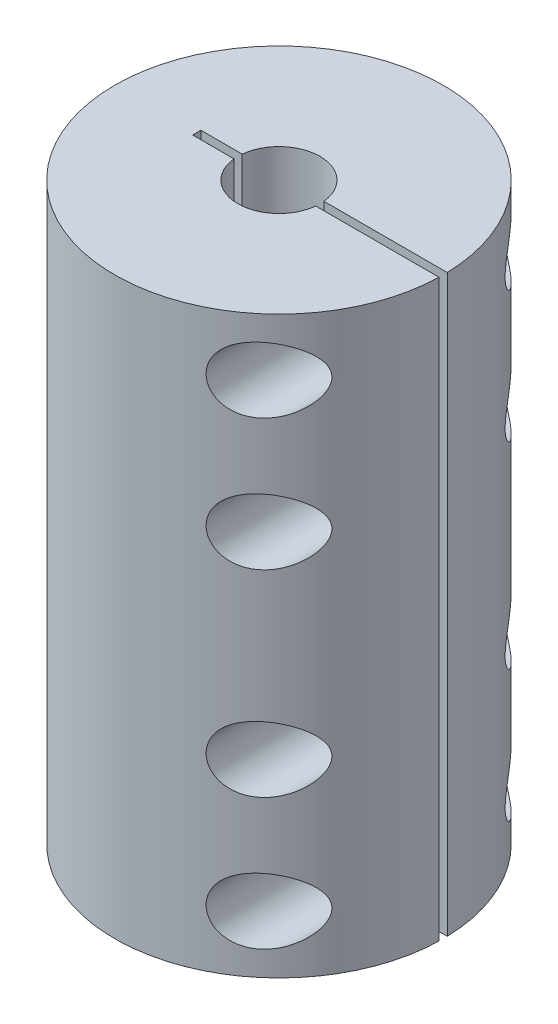
from build123d import *

# Parameters (mm, degrees)
SKETCH1_R               = 10
BOSS_EXTRUDE1_DEPTH     = 35
CUT_EXTRUDE1_DEPTH      = 38.749172176
CUT_EXTRUDE1_DEPTH_BACK = 38.749172176
SKETCH2_R               = 2.5
SKETCH3_R               = 4
CUT_EXTRUDE2_DEPTH      = 17.5
CUT_EXTRUDE3_DEPTH      = 38.749172176
CUT_EXTRUDE3_DEPTH_BACK = 38.749172176
SKETCH4_W               = 15
SKETCH4_H               = 0.5
CUT_EXTRUDE4_DEPTH      = 38.749172176
CUT_EXTRUDE4_DEPTH_BACK = 38.749172176
SKETCH5_R               = 2


with BuildPart() as part:
    # Sketch1 → Boss-Extrude1 (new body)
    with BuildSketch(Plane(origin=(0, 0, 0), x_dir=(1, 0, 0), z_dir=(0, 1, 0))):
        with Locations(Location((0, 0, 0), (0, 0, 270))):
            Circle(SKETCH1_R)
    extrude(amount=BOSS_EXTRUDE1_DEPTH)

    # Sketch2 → Cut-Extrude1 (cut, two sides: drawn at the far end of the back side and taken through both)
    with BuildSketch(Plane(origin=(0, 35, 0), x_dir=(1, 0, 0), z_dir=(0, 1, 0)).offset(-CUT_EXTRUDE1_DEPTH_BACK)):
        with Locations(Location((0, 0, 0), (0, 0, 270))):
            Circle(SKETCH2_R)
    extrude(amount=CUT_EXTRUDE1_DEPTH + CUT_EXTRUDE1_DEPTH_BACK, mode=Mode.SUBTRACT)

    # Sketch3 → Cut-Extrude2 (cut)
    with BuildSketch(Plane.XZ):
        with Locations(Location((0, 0, 0), (0, 0, 270))):
            Circle(SKETCH3_R)
    extrude(amount=-CUT_EXTRUDE2_DEPTH, mode=Mode.SUBTRACT)

    # Sketch4 → Cut-Extrude3 (cut, two sides: drawn at the far end of the back side and taken through both)
    with BuildSketch(Plane.XZ.offset(-CUT_EXTRUDE3_DEPTH_BACK)):
        with Locations((2.5, 0)):
            Rectangle(SKETCH4_W, SKETCH4_H)
    extrude(amount=CUT_EXTRUDE3_DEPTH + CUT_EXTRUDE3_DEPTH_BACK, mode=Mode.SUBTRACT)

    # Sketch5 → Cut-Extrude4 (cut, two sides: drawn at the far end of the back side and taken through both)
    with BuildSketch(Plane.XY.offset(-CUT_EXTRUDE4_DEPTH_BACK)):
        with Locations((6.496874512, 31.5)):
            Circle(SKETCH5_R)
        with Locations((6.496874512, 23.5)):
            Circle(SKETCH5_R)
        with Locations((6.496874512, 11.5)):
            Circle(SKETCH5_R)
        with Locations((6.496874512, 3.5)):
            Circle(SKETCH5_R)
    extrude(amount=CUT_EXTRUDE4_DEPTH + CUT_EXTRUDE4_DEPTH_BACK, mode=Mode.SUBTRACT)


solid = part.part
